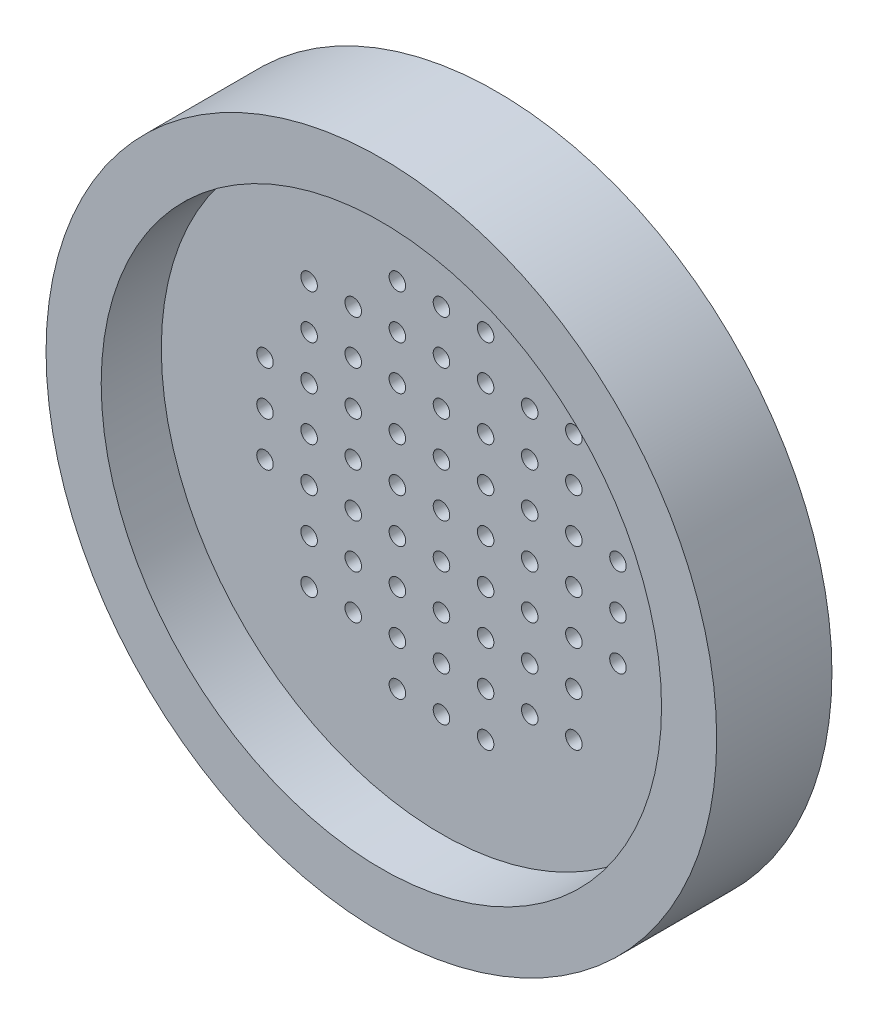
from build123d import *

# Parameters (mm, degrees)
SKETCH1_R                                  = 30.4
BOSS_EXTRUDE1_DEPTH                        = 5
SKETCH2_R                                  = 0.75
CUT_EXTRUDE1_DEPTH                         = 44.281866873
LPATTERN1_COUNT                            = 5
LPATTERN1_PITCH                            = 4
LPATTERN1_COUNT_DIR2                       = 5
LPATTERN1_PITCH_DIR2                       = 4
MIRROR1_COPY_1_SKETCH_R                    = 0.75
MIRROR1_COPY_1_DEPTH                       = 44.281866873
MIRROR1_COPY_2_SKETCH_R                    = 0.75
MIRROR1_COPY_2_DEPTH                       = 44.281866873
MIRROR1_COPY_3_SKETCH_R                    = 0.75
MIRROR1_COPY_3_DEPTH                       = 44.281866873
MIRROR1_COPY_4_SKETCH_R                    = 0.75
MIRROR1_COPY_4_DEPTH                       = 44.281866873
MIRROR1_COPY_5_SKETCH_R                    = 0.75
MIRROR1_COPY_5_DEPTH                       = 44.281866873
MIRROR1_COPY_6_SKETCH_R                    = 0.75
MIRROR1_COPY_6_DEPTH                       = 44.281866873
MIRROR1_COPY_7_SKETCH_R                    = 0.75
MIRROR1_COPY_7_DEPTH                       = 44.281866873
MIRROR1_COPY_8_SKETCH_R                    = 0.75
MIRROR1_COPY_8_DEPTH                       = 44.281866873
MIRROR1_COPY_9_SKETCH_R                    = 0.75
MIRROR1_COPY_9_DEPTH                       = 44.281866873
MIRROR1_COPY_10_SKETCH_R                   = 0.75
MIRROR1_COPY_10_DEPTH                      = 44.281866873
MIRROR1_COPY_11_SKETCH_R                   = 0.75
MIRROR1_COPY_11_DEPTH                      = 44.281866873
MIRROR1_COPY_12_SKETCH_R                   = 0.75
MIRROR1_COPY_12_DEPTH                      = 44.281866873
MIRROR1_COPY_13_SKETCH_R                   = 0.75
MIRROR1_COPY_13_DEPTH                      = 44.281866873
MIRROR1_COPY_14_SKETCH_R                   = 0.75
MIRROR1_COPY_14_DEPTH                      = 44.281866873
MIRROR1_COPY_15_SKETCH_R                   = 0.75
MIRROR1_COPY_15_DEPTH                      = 44.281866873
MIRROR1_COPY_16_SKETCH_R                   = 0.75
MIRROR1_COPY_16_DEPTH                      = 44.281866873
MIRROR1_COPY_17_SKETCH_R                   = 0.75
MIRROR1_COPY_17_DEPTH                      = 44.281866873
MIRROR1_COPY_18_SKETCH_R                   = 0.75
MIRROR1_COPY_18_DEPTH                      = 44.281866873
MIRROR1_COPY_19_SKETCH_R                   = 0.75
MIRROR1_COPY_19_DEPTH                      = 44.281866873
MIRROR1_COPY_20_SKETCH_R                   = 0.75
MIRROR1_COPY_20_DEPTH                      = 44.281866873
MIRROR1_AT_THE_SECOND_PLANE_COPY_1_SKETC_R = 0.75
MIRROR1_AT_THE_SECOND_PLANE_COPY_1_DEPTH   = 44.281866873
MIRROR1_AT_THE_SECOND_PLANE_COPY_2_SKETC_R = 0.75
MIRROR1_AT_THE_SECOND_PLANE_COPY_2_DEPTH   = 44.281866873
MIRROR1_AT_THE_SECOND_PLANE_COPY_3_SKETC_R = 0.75
MIRROR1_AT_THE_SECOND_PLANE_COPY_3_DEPTH   = 44.281866873
MIRROR1_AT_THE_SECOND_PLANE_COPY_4_SKETC_R = 0.75
MIRROR1_AT_THE_SECOND_PLANE_COPY_4_DEPTH   = 44.281866873
MIRROR1_AT_THE_SECOND_PLANE_COPY_5_SKETC_R = 0.75
MIRROR1_AT_THE_SECOND_PLANE_COPY_5_DEPTH   = 44.281866873
MIRROR1_AT_THE_SECOND_PLANE_COPY_6_SKETC_R = 0.75
MIRROR1_AT_THE_SECOND_PLANE_COPY_6_DEPTH   = 44.281866873
MIRROR1_AT_THE_SECOND_PLANE_COPY_7_SKETC_R = 0.75
MIRROR1_AT_THE_SECOND_PLANE_COPY_7_DEPTH   = 44.281866873
MIRROR1_AT_THE_SECOND_PLANE_COPY_8_SKETC_R = 0.75
MIRROR1_AT_THE_SECOND_PLANE_COPY_8_DEPTH   = 44.281866873
MIRROR1_AT_THE_SECOND_PLANE_COPY_9_SKETC_R = 0.75
MIRROR1_AT_THE_SECOND_PLANE_COPY_9_DEPTH   = 44.281866873
MIRROR1_AT_THE_SECOND_PLANE_COPY_10_SKET_R = 0.75
MIRROR1_AT_THE_SECOND_PLANE_COPY_10_DEPTH  = 44.281866873
MIRROR1_AT_THE_SECOND_PLANE_COPY_11_SKET_R = 0.75
MIRROR1_AT_THE_SECOND_PLANE_COPY_11_DEPTH  = 44.281866873
MIRROR1_AT_THE_SECOND_PLANE_COPY_12_SKET_R = 0.75
MIRROR1_AT_THE_SECOND_PLANE_COPY_12_DEPTH  = 44.281866873
MIRROR1_AT_THE_SECOND_PLANE_COPY_13_SKET_R = 0.75
MIRROR1_AT_THE_SECOND_PLANE_COPY_13_DEPTH  = 44.281866873
MIRROR1_AT_THE_SECOND_PLANE_COPY_14_SKET_R = 0.75
MIRROR1_AT_THE_SECOND_PLANE_COPY_14_DEPTH  = 44.281866873
MIRROR1_AT_THE_SECOND_PLANE_COPY_15_SKET_R = 0.75
MIRROR1_AT_THE_SECOND_PLANE_COPY_15_DEPTH  = 44.281866873
MIRROR1_AT_THE_SECOND_PLANE_COPY_16_SKET_R = 0.75
MIRROR1_AT_THE_SECOND_PLANE_COPY_16_DEPTH  = 44.281866873
MIRROR1_AT_THE_SECOND_PLANE_COPY_17_SKET_R = 0.75
MIRROR1_AT_THE_SECOND_PLANE_COPY_17_DEPTH  = 44.281866873
MIRROR1_AT_THE_SECOND_PLANE_COPY_18_SKET_R = 0.75
MIRROR1_AT_THE_SECOND_PLANE_COPY_18_DEPTH  = 44.281866873
MIRROR1_AT_THE_SECOND_PLANE_COPY_19_SKET_R = 0.75
MIRROR1_AT_THE_SECOND_PLANE_COPY_19_DEPTH  = 44.281866873
MIRROR1_AT_THE_SECOND_PLANE_COPY_20_SKET_R = 0.75
MIRROR1_AT_THE_SECOND_PLANE_COPY_20_DEPTH  = 44.281866873
MIRROR1_AT_THE_SECOND_PLANE_COPY_21_SKET_R = 0.75
MIRROR1_AT_THE_SECOND_PLANE_COPY_21_DEPTH  = 44.281866873
MIRROR1_AT_THE_SECOND_PLANE_COPY_22_SKET_R = 0.75
MIRROR1_AT_THE_SECOND_PLANE_COPY_22_DEPTH  = 44.281866873
MIRROR1_AT_THE_SECOND_PLANE_COPY_23_SKET_R = 0.75
MIRROR1_AT_THE_SECOND_PLANE_COPY_23_DEPTH  = 44.281866873
MIRROR1_AT_THE_SECOND_PLANE_COPY_24_SKET_R = 0.75
MIRROR1_AT_THE_SECOND_PLANE_COPY_24_DEPTH  = 44.281866873
MIRROR1_AT_THE_SECOND_PLANE_COPY_25_SKET_R = 0.75
MIRROR1_AT_THE_SECOND_PLANE_COPY_25_DEPTH  = 44.281866873
MIRROR1_AT_THE_SECOND_PLANE_COPY_26_SKET_R = 0.75
MIRROR1_AT_THE_SECOND_PLANE_COPY_26_DEPTH  = 44.281866873
MIRROR1_AT_THE_SECOND_PLANE_COPY_27_SKET_R = 0.75
MIRROR1_AT_THE_SECOND_PLANE_COPY_27_DEPTH  = 44.281866873
MIRROR1_AT_THE_SECOND_PLANE_COPY_28_SKET_R = 0.75
MIRROR1_AT_THE_SECOND_PLANE_COPY_28_DEPTH  = 44.281866873
MIRROR1_AT_THE_SECOND_PLANE_COPY_29_SKET_R = 0.75
MIRROR1_AT_THE_SECOND_PLANE_COPY_29_DEPTH  = 44.281866873
MIRROR1_AT_THE_SECOND_PLANE_COPY_30_SKET_R = 0.75
MIRROR1_AT_THE_SECOND_PLANE_COPY_30_DEPTH  = 44.281866873
MIRROR1_AT_THE_SECOND_PLANE_COPY_31_SKET_R = 0.75
MIRROR1_AT_THE_SECOND_PLANE_COPY_31_DEPTH  = 44.281866873
MIRROR1_AT_THE_SECOND_PLANE_COPY_32_SKET_R = 0.75
MIRROR1_AT_THE_SECOND_PLANE_COPY_32_DEPTH  = 44.281866873
MIRROR1_AT_THE_SECOND_PLANE_COPY_33_SKET_R = 0.75
MIRROR1_AT_THE_SECOND_PLANE_COPY_33_DEPTH  = 44.281866873
MIRROR1_AT_THE_SECOND_PLANE_COPY_34_SKET_R = 0.75
MIRROR1_AT_THE_SECOND_PLANE_COPY_34_DEPTH  = 44.281866873
MIRROR1_AT_THE_SECOND_PLANE_COPY_35_SKET_R = 0.75
MIRROR1_AT_THE_SECOND_PLANE_COPY_35_DEPTH  = 44.281866873
MIRROR1_AT_THE_SECOND_PLANE_COPY_36_SKET_R = 0.75
MIRROR1_AT_THE_SECOND_PLANE_COPY_36_DEPTH  = 44.281866873
MIRROR1_AT_THE_SECOND_PLANE_COPY_37_SKET_R = 0.75
MIRROR1_AT_THE_SECOND_PLANE_COPY_37_DEPTH  = 44.281866873
MIRROR1_AT_THE_SECOND_PLANE_COPY_38_SKET_R = 0.75
MIRROR1_AT_THE_SECOND_PLANE_COPY_38_DEPTH  = 44.281866873
MIRROR1_AT_THE_SECOND_PLANE_COPY_39_SKET_R = 0.75
MIRROR1_AT_THE_SECOND_PLANE_COPY_39_DEPTH  = 44.281866873
MIRROR1_AT_THE_SECOND_PLANE_COPY_40_SKET_R = 0.75
MIRROR1_AT_THE_SECOND_PLANE_COPY_40_DEPTH  = 44.281866873
MIRROR1_AT_THE_SECOND_PLANE_COPY_41_SKET_R = 0.75
MIRROR1_AT_THE_SECOND_PLANE_COPY_41_DEPTH  = 44.281866873
SKETCH16_R                                 = 30.4
SKETCH16_R_2                               = 25.4
BOSS_EXTRUDE2_DEPTH                        = 5.45


with BuildPart() as part:
    # Sketch1 → Boss-Extrude1 (new body)
    with BuildSketch(Plane.XY):
        Circle(SKETCH1_R)
    extrude(amount=BOSS_EXTRUDE1_DEPTH)

    # Sketch2 → Cut-Extrude1 (cut, through all)
    with BuildSketch(Plane.XY.offset(5)):
        Circle(SKETCH2_R)
    cut_extrude1 = extrude(amount=-CUT_EXTRUDE1_DEPTH, mode=Mode.SUBTRACT)

    # LPattern1: Cut-Extrude1 5 × 5, 5 skipped
    with Locations(*[(j * LPATTERN1_PITCH_DIR2, i * LPATTERN1_PITCH, 0) for i in range(LPATTERN1_COUNT) for j in range(LPATTERN1_COUNT_DIR2) if (i, j) not in ((0, 0), (2, 4), (3, 4), (4, 2), (4, 3), (4, 4))]):
        add(cut_extrude1, mode=Mode.SUBTRACT)

    # Mirror1 copy 1 sketch → Mirror1 copy 1 (cut, through all)
    with BuildSketch(Plane(origin=(-4, 0, 5), x_dir=(-1, 0, 0), z_dir=(0, 0, 1))):
        Circle(MIRROR1_COPY_1_SKETCH_R)
    extrude(amount=-MIRROR1_COPY_1_DEPTH, mode=Mode.SUBTRACT)

    # Mirror1 copy 2 sketch → Mirror1 copy 2 (cut, through all)
    with BuildSketch(Plane(origin=(-8, 0, 5), x_dir=(-1, 0, 0), z_dir=(0, 0, 1))):
        Circle(MIRROR1_COPY_2_SKETCH_R)
    extrude(amount=-MIRROR1_COPY_2_DEPTH, mode=Mode.SUBTRACT)

    # Mirror1 copy 3 sketch → Mirror1 copy 3 (cut, through all)
    with BuildSketch(Plane(origin=(-12, 0, 5), x_dir=(-1, 0, 0), z_dir=(0, 0, 1))):
        Circle(MIRROR1_COPY_3_SKETCH_R)
    extrude(amount=-MIRROR1_COPY_3_DEPTH, mode=Mode.SUBTRACT)

    # Mirror1 copy 4 sketch → Mirror1 copy 4 (cut, through all)
    with BuildSketch(Plane(origin=(-16, 0, 5), x_dir=(-1, 0, 0), z_dir=(0, 0, 1))):
        Circle(MIRROR1_COPY_4_SKETCH_R)
    extrude(amount=-MIRROR1_COPY_4_DEPTH, mode=Mode.SUBTRACT)

    # Mirror1 copy 5 sketch → Mirror1 copy 5 (cut, through all)
    with BuildSketch(Plane(origin=(0, 4, 5), x_dir=(-1, 0, 0), z_dir=(0, 0, 1))):
        Circle(MIRROR1_COPY_5_SKETCH_R)
    extrude(amount=-MIRROR1_COPY_5_DEPTH, mode=Mode.SUBTRACT)

    # Mirror1 copy 6 sketch → Mirror1 copy 6 (cut, through all)
    with BuildSketch(Plane(origin=(-4, 4, 5), x_dir=(-1, 0, 0), z_dir=(0, 0, 1))):
        Circle(MIRROR1_COPY_6_SKETCH_R)
    extrude(amount=-MIRROR1_COPY_6_DEPTH, mode=Mode.SUBTRACT)

    # Mirror1 copy 7 sketch → Mirror1 copy 7 (cut, through all)
    with BuildSketch(Plane(origin=(-8, 4, 5), x_dir=(-1, 0, 0), z_dir=(0, 0, 1))):
        Circle(MIRROR1_COPY_7_SKETCH_R)
    extrude(amount=-MIRROR1_COPY_7_DEPTH, mode=Mode.SUBTRACT)

    # Mirror1 copy 8 sketch → Mirror1 copy 8 (cut, through all)
    with BuildSketch(Plane(origin=(-12, 4, 5), x_dir=(-1, 0, 0), z_dir=(0, 0, 1))):
        Circle(MIRROR1_COPY_8_SKETCH_R)
    extrude(amount=-MIRROR1_COPY_8_DEPTH, mode=Mode.SUBTRACT)

    # Mirror1 copy 9 sketch → Mirror1 copy 9 (cut, through all)
    with BuildSketch(Plane(origin=(-16, 4, 5), x_dir=(-1, 0, 0), z_dir=(0, 0, 1))):
        Circle(MIRROR1_COPY_9_SKETCH_R)
    extrude(amount=-MIRROR1_COPY_9_DEPTH, mode=Mode.SUBTRACT)

    # Mirror1 copy 10 sketch → Mirror1 copy 10 (cut, through all)
    with BuildSketch(Plane(origin=(0, 8, 5), x_dir=(-1, 0, 0), z_dir=(0, 0, 1))):
        Circle(MIRROR1_COPY_10_SKETCH_R)
    extrude(amount=-MIRROR1_COPY_10_DEPTH, mode=Mode.SUBTRACT)

    # Mirror1 copy 11 sketch → Mirror1 copy 11 (cut, through all)
    with BuildSketch(Plane(origin=(-4, 8, 5), x_dir=(-1, 0, 0), z_dir=(0, 0, 1))):
        Circle(MIRROR1_COPY_11_SKETCH_R)
    extrude(amount=-MIRROR1_COPY_11_DEPTH, mode=Mode.SUBTRACT)

    # Mirror1 copy 12 sketch → Mirror1 copy 12 (cut, through all)
    with BuildSketch(Plane(origin=(-8, 8, 5), x_dir=(-1, 0, 0), z_dir=(0, 0, 1))):
        Circle(MIRROR1_COPY_12_SKETCH_R)
    extrude(amount=-MIRROR1_COPY_12_DEPTH, mode=Mode.SUBTRACT)

    # Mirror1 copy 13 sketch → Mirror1 copy 13 (cut, through all)
    with BuildSketch(Plane(origin=(-12, 8, 5), x_dir=(-1, 0, 0), z_dir=(0, 0, 1))):
        Circle(MIRROR1_COPY_13_SKETCH_R)
    extrude(amount=-MIRROR1_COPY_13_DEPTH, mode=Mode.SUBTRACT)

    # Mirror1 copy 14 sketch → Mirror1 copy 14 (cut, through all)
    with BuildSketch(Plane(origin=(0, 12, 5), x_dir=(-1, 0, 0), z_dir=(0, 0, 1))):
        Circle(MIRROR1_COPY_14_SKETCH_R)
    extrude(amount=-MIRROR1_COPY_14_DEPTH, mode=Mode.SUBTRACT)

    # Mirror1 copy 15 sketch → Mirror1 copy 15 (cut, through all)
    with BuildSketch(Plane(origin=(-4, 12, 5), x_dir=(-1, 0, 0), z_dir=(0, 0, 1))):
        Circle(MIRROR1_COPY_15_SKETCH_R)
    extrude(amount=-MIRROR1_COPY_15_DEPTH, mode=Mode.SUBTRACT)

    # Mirror1 copy 16 sketch → Mirror1 copy 16 (cut, through all)
    with BuildSketch(Plane(origin=(-8, 12, 5), x_dir=(-1, 0, 0), z_dir=(0, 0, 1))):
        Circle(MIRROR1_COPY_16_SKETCH_R)
    extrude(amount=-MIRROR1_COPY_16_DEPTH, mode=Mode.SUBTRACT)

    # Mirror1 copy 17 sketch → Mirror1 copy 17 (cut, through all)
    with BuildSketch(Plane(origin=(-12, 12, 5), x_dir=(-1, 0, 0), z_dir=(0, 0, 1))):
        Circle(MIRROR1_COPY_17_SKETCH_R)
    extrude(amount=-MIRROR1_COPY_17_DEPTH, mode=Mode.SUBTRACT)

    # Mirror1 copy 18 sketch → Mirror1 copy 18 (cut, through all)
    with BuildSketch(Plane(origin=(0, 16, 5), x_dir=(-1, 0, 0), z_dir=(0, 0, 1))):
        Circle(MIRROR1_COPY_18_SKETCH_R)
    extrude(amount=-MIRROR1_COPY_18_DEPTH, mode=Mode.SUBTRACT)

    # Mirror1 copy 19 sketch → Mirror1 copy 19 (cut, through all)
    with BuildSketch(Plane(origin=(-4, 16, 5), x_dir=(-1, 0, 0), z_dir=(0, 0, 1))):
        Circle(MIRROR1_COPY_19_SKETCH_R)
    extrude(amount=-MIRROR1_COPY_19_DEPTH, mode=Mode.SUBTRACT)

    # Mirror1 copy 20 sketch → Mirror1 copy 20 (cut, through all)
    with BuildSketch(Plane(origin=(0, 0, 5), x_dir=(-1, 0, 0), z_dir=(0, 0, 1))):
        Circle(MIRROR1_COPY_20_SKETCH_R)
    extrude(amount=-MIRROR1_COPY_20_DEPTH, mode=Mode.SUBTRACT)

    # Mirror1 at the second plane copy 1 sketc → Mirror1 at the second plane copy 1 (cut, through all)
    with BuildSketch(Plane(origin=(4, 0, 5), x_dir=(1, 0, 0), z_dir=(0, 0, 1))):
        Circle(MIRROR1_AT_THE_SECOND_PLANE_COPY_1_SKETC_R)
    extrude(amount=-MIRROR1_AT_THE_SECOND_PLANE_COPY_1_DEPTH, mode=Mode.SUBTRACT)

    # Mirror1 at the second plane copy 2 sketc → Mirror1 at the second plane copy 2 (cut, through all)
    with BuildSketch(Plane(origin=(8, 0, 5), x_dir=(1, 0, 0), z_dir=(0, 0, 1))):
        Circle(MIRROR1_AT_THE_SECOND_PLANE_COPY_2_SKETC_R)
    extrude(amount=-MIRROR1_AT_THE_SECOND_PLANE_COPY_2_DEPTH, mode=Mode.SUBTRACT)

    # Mirror1 at the second plane copy 3 sketc → Mirror1 at the second plane copy 3 (cut, through all)
    with BuildSketch(Plane(origin=(12, 0, 5), x_dir=(1, 0, 0), z_dir=(0, 0, 1))):
        Circle(MIRROR1_AT_THE_SECOND_PLANE_COPY_3_SKETC_R)
    extrude(amount=-MIRROR1_AT_THE_SECOND_PLANE_COPY_3_DEPTH, mode=Mode.SUBTRACT)

    # Mirror1 at the second plane copy 4 sketc → Mirror1 at the second plane copy 4 (cut, through all)
    with BuildSketch(Plane(origin=(16, 0, 5), x_dir=(1, 0, 0), z_dir=(0, 0, 1))):
        Circle(MIRROR1_AT_THE_SECOND_PLANE_COPY_4_SKETC_R)
    extrude(amount=-MIRROR1_AT_THE_SECOND_PLANE_COPY_4_DEPTH, mode=Mode.SUBTRACT)

    # Mirror1 at the second plane copy 5 sketc → Mirror1 at the second plane copy 5 (cut, through all)
    with BuildSketch(Plane(origin=(0, -4, 5), x_dir=(1, 0, 0), z_dir=(0, 0, 1))):
        Circle(MIRROR1_AT_THE_SECOND_PLANE_COPY_5_SKETC_R)
    extrude(amount=-MIRROR1_AT_THE_SECOND_PLANE_COPY_5_DEPTH, mode=Mode.SUBTRACT)

    # Mirror1 at the second plane copy 6 sketc → Mirror1 at the second plane copy 6 (cut, through all)
    with BuildSketch(Plane(origin=(4, -4, 5), x_dir=(1, 0, 0), z_dir=(0, 0, 1))):
        Circle(MIRROR1_AT_THE_SECOND_PLANE_COPY_6_SKETC_R)
    extrude(amount=-MIRROR1_AT_THE_SECOND_PLANE_COPY_6_DEPTH, mode=Mode.SUBTRACT)

    # Mirror1 at the second plane copy 7 sketc → Mirror1 at the second plane copy 7 (cut, through all)
    with BuildSketch(Plane(origin=(8, -4, 5), x_dir=(1, 0, 0), z_dir=(0, 0, 1))):
        Circle(MIRROR1_AT_THE_SECOND_PLANE_COPY_7_SKETC_R)
    extrude(amount=-MIRROR1_AT_THE_SECOND_PLANE_COPY_7_DEPTH, mode=Mode.SUBTRACT)

    # Mirror1 at the second plane copy 8 sketc → Mirror1 at the second plane copy 8 (cut, through all)
    with BuildSketch(Plane(origin=(12, -4, 5), x_dir=(1, 0, 0), z_dir=(0, 0, 1))):
        Circle(MIRROR1_AT_THE_SECOND_PLANE_COPY_8_SKETC_R)
    extrude(amount=-MIRROR1_AT_THE_SECOND_PLANE_COPY_8_DEPTH, mode=Mode.SUBTRACT)

    # Mirror1 at the second plane copy 9 sketc → Mirror1 at the second plane copy 9 (cut, through all)
    with BuildSketch(Plane(origin=(16, -4, 5), x_dir=(1, 0, 0), z_dir=(0, 0, 1))):
        Circle(MIRROR1_AT_THE_SECOND_PLANE_COPY_9_SKETC_R)
    extrude(amount=-MIRROR1_AT_THE_SECOND_PLANE_COPY_9_DEPTH, mode=Mode.SUBTRACT)

    # Mirror1 at the second plane copy 10 sket → Mirror1 at the second plane copy 10 (cut, through all)
    with BuildSketch(Plane(origin=(0, -8, 5), x_dir=(1, 0, 0), z_dir=(0, 0, 1))):
        Circle(MIRROR1_AT_THE_SECOND_PLANE_COPY_10_SKET_R)
    extrude(amount=-MIRROR1_AT_THE_SECOND_PLANE_COPY_10_DEPTH, mode=Mode.SUBTRACT)

    # Mirror1 at the second plane copy 11 sket → Mirror1 at the second plane copy 11 (cut, through all)
    with BuildSketch(Plane(origin=(4, -8, 5), x_dir=(1, 0, 0), z_dir=(0, 0, 1))):
        Circle(MIRROR1_AT_THE_SECOND_PLANE_COPY_11_SKET_R)
    extrude(amount=-MIRROR1_AT_THE_SECOND_PLANE_COPY_11_DEPTH, mode=Mode.SUBTRACT)

    # Mirror1 at the second plane copy 12 sket → Mirror1 at the second plane copy 12 (cut, through all)
    with BuildSketch(Plane(origin=(8, -8, 5), x_dir=(1, 0, 0), z_dir=(0, 0, 1))):
        Circle(MIRROR1_AT_THE_SECOND_PLANE_COPY_12_SKET_R)
    extrude(amount=-MIRROR1_AT_THE_SECOND_PLANE_COPY_12_DEPTH, mode=Mode.SUBTRACT)

    # Mirror1 at the second plane copy 13 sket → Mirror1 at the second plane copy 13 (cut, through all)
    with BuildSketch(Plane(origin=(12, -8, 5), x_dir=(1, 0, 0), z_dir=(0, 0, 1))):
        Circle(MIRROR1_AT_THE_SECOND_PLANE_COPY_13_SKET_R)
    extrude(amount=-MIRROR1_AT_THE_SECOND_PLANE_COPY_13_DEPTH, mode=Mode.SUBTRACT)

    # Mirror1 at the second plane copy 14 sket → Mirror1 at the second plane copy 14 (cut, through all)
    with BuildSketch(Plane(origin=(0, -12, 5), x_dir=(1, 0, 0), z_dir=(0, 0, 1))):
        Circle(MIRROR1_AT_THE_SECOND_PLANE_COPY_14_SKET_R)
    extrude(amount=-MIRROR1_AT_THE_SECOND_PLANE_COPY_14_DEPTH, mode=Mode.SUBTRACT)

    # Mirror1 at the second plane copy 15 sket → Mirror1 at the second plane copy 15 (cut, through all)
    with BuildSketch(Plane(origin=(4, -12, 5), x_dir=(1, 0, 0), z_dir=(0, 0, 1))):
        Circle(MIRROR1_AT_THE_SECOND_PLANE_COPY_15_SKET_R)
    extrude(amount=-MIRROR1_AT_THE_SECOND_PLANE_COPY_15_DEPTH, mode=Mode.SUBTRACT)

    # Mirror1 at the second plane copy 16 sket → Mirror1 at the second plane copy 16 (cut, through all)
    with BuildSketch(Plane(origin=(8, -12, 5), x_dir=(1, 0, 0), z_dir=(0, 0, 1))):
        Circle(MIRROR1_AT_THE_SECOND_PLANE_COPY_16_SKET_R)
    extrude(amount=-MIRROR1_AT_THE_SECOND_PLANE_COPY_16_DEPTH, mode=Mode.SUBTRACT)

    # Mirror1 at the second plane copy 17 sket → Mirror1 at the second plane copy 17 (cut, through all)
    with BuildSketch(Plane(origin=(12, -12, 5), x_dir=(1, 0, 0), z_dir=(0, 0, 1))):
        Circle(MIRROR1_AT_THE_SECOND_PLANE_COPY_17_SKET_R)
    extrude(amount=-MIRROR1_AT_THE_SECOND_PLANE_COPY_17_DEPTH, mode=Mode.SUBTRACT)

    # Mirror1 at the second plane copy 18 sket → Mirror1 at the second plane copy 18 (cut, through all)
    with BuildSketch(Plane(origin=(0, -16, 5), x_dir=(1, 0, 0), z_dir=(0, 0, 1))):
        Circle(MIRROR1_AT_THE_SECOND_PLANE_COPY_18_SKET_R)
    extrude(amount=-MIRROR1_AT_THE_SECOND_PLANE_COPY_18_DEPTH, mode=Mode.SUBTRACT)

    # Mirror1 at the second plane copy 19 sket → Mirror1 at the second plane copy 19 (cut, through all)
    with BuildSketch(Plane(origin=(4, -16, 5), x_dir=(1, 0, 0), z_dir=(0, 0, 1))):
        Circle(MIRROR1_AT_THE_SECOND_PLANE_COPY_19_SKET_R)
    extrude(amount=-MIRROR1_AT_THE_SECOND_PLANE_COPY_19_DEPTH, mode=Mode.SUBTRACT)

    # Mirror1 at the second plane copy 20 sket → Mirror1 at the second plane copy 20 (cut, through all)
    with BuildSketch(Plane.XY.offset(5)):
        Circle(MIRROR1_AT_THE_SECOND_PLANE_COPY_20_SKET_R)
    extrude(amount=-MIRROR1_AT_THE_SECOND_PLANE_COPY_20_DEPTH, mode=Mode.SUBTRACT)

    # Mirror1 at the second plane copy 21 sket → Mirror1 at the second plane copy 21 (cut, through all)
    with BuildSketch(Plane(origin=(-4, 0, 5), x_dir=(-1, 0, 0), z_dir=(0, 0, 1))):
        Circle(MIRROR1_AT_THE_SECOND_PLANE_COPY_21_SKET_R)
    extrude(amount=-MIRROR1_AT_THE_SECOND_PLANE_COPY_21_DEPTH, mode=Mode.SUBTRACT)

    # Mirror1 at the second plane copy 22 sket → Mirror1 at the second plane copy 22 (cut, through all)
    with BuildSketch(Plane(origin=(-8, 0, 5), x_dir=(-1, 0, 0), z_dir=(0, 0, 1))):
        Circle(MIRROR1_AT_THE_SECOND_PLANE_COPY_22_SKET_R)
    extrude(amount=-MIRROR1_AT_THE_SECOND_PLANE_COPY_22_DEPTH, mode=Mode.SUBTRACT)

    # Mirror1 at the second plane copy 23 sket → Mirror1 at the second plane copy 23 (cut, through all)
    with BuildSketch(Plane(origin=(-12, 0, 5), x_dir=(-1, 0, 0), z_dir=(0, 0, 1))):
        Circle(MIRROR1_AT_THE_SECOND_PLANE_COPY_23_SKET_R)
    extrude(amount=-MIRROR1_AT_THE_SECOND_PLANE_COPY_23_DEPTH, mode=Mode.SUBTRACT)

    # Mirror1 at the second plane copy 24 sket → Mirror1 at the second plane copy 24 (cut, through all)
    with BuildSketch(Plane(origin=(-16, 0, 5), x_dir=(-1, 0, 0), z_dir=(0, 0, 1))):
        Circle(MIRROR1_AT_THE_SECOND_PLANE_COPY_24_SKET_R)
    extrude(amount=-MIRROR1_AT_THE_SECOND_PLANE_COPY_24_DEPTH, mode=Mode.SUBTRACT)

    # Mirror1 at the second plane copy 25 sket → Mirror1 at the second plane copy 25 (cut, through all)
    with BuildSketch(Plane(origin=(0, -4, 5), x_dir=(-1, 0, 0), z_dir=(0, 0, 1))):
        Circle(MIRROR1_AT_THE_SECOND_PLANE_COPY_25_SKET_R)
    extrude(amount=-MIRROR1_AT_THE_SECOND_PLANE_COPY_25_DEPTH, mode=Mode.SUBTRACT)

    # Mirror1 at the second plane copy 26 sket → Mirror1 at the second plane copy 26 (cut, through all)
    with BuildSketch(Plane(origin=(-4, -4, 5), x_dir=(-1, 0, 0), z_dir=(0, 0, 1))):
        Circle(MIRROR1_AT_THE_SECOND_PLANE_COPY_26_SKET_R)
    extrude(amount=-MIRROR1_AT_THE_SECOND_PLANE_COPY_26_DEPTH, mode=Mode.SUBTRACT)

    # Mirror1 at the second plane copy 27 sket → Mirror1 at the second plane copy 27 (cut, through all)
    with BuildSketch(Plane(origin=(-8, -4, 5), x_dir=(-1, 0, 0), z_dir=(0, 0, 1))):
        Circle(MIRROR1_AT_THE_SECOND_PLANE_COPY_27_SKET_R)
    extrude(amount=-MIRROR1_AT_THE_SECOND_PLANE_COPY_27_DEPTH, mode=Mode.SUBTRACT)

    # Mirror1 at the second plane copy 28 sket → Mirror1 at the second plane copy 28 (cut, through all)
    with BuildSketch(Plane(origin=(-12, -4, 5), x_dir=(-1, 0, 0), z_dir=(0, 0, 1))):
        Circle(MIRROR1_AT_THE_SECOND_PLANE_COPY_28_SKET_R)
    extrude(amount=-MIRROR1_AT_THE_SECOND_PLANE_COPY_28_DEPTH, mode=Mode.SUBTRACT)

    # Mirror1 at the second plane copy 29 sket → Mirror1 at the second plane copy 29 (cut, through all)
    with BuildSketch(Plane(origin=(-16, -4, 5), x_dir=(-1, 0, 0), z_dir=(0, 0, 1))):
        Circle(MIRROR1_AT_THE_SECOND_PLANE_COPY_29_SKET_R)
    extrude(amount=-MIRROR1_AT_THE_SECOND_PLANE_COPY_29_DEPTH, mode=Mode.SUBTRACT)

    # Mirror1 at the second plane copy 30 sket → Mirror1 at the second plane copy 30 (cut, through all)
    with BuildSketch(Plane(origin=(0, -8, 5), x_dir=(-1, 0, 0), z_dir=(0, 0, 1))):
        Circle(MIRROR1_AT_THE_SECOND_PLANE_COPY_30_SKET_R)
    extrude(amount=-MIRROR1_AT_THE_SECOND_PLANE_COPY_30_DEPTH, mode=Mode.SUBTRACT)

    # Mirror1 at the second plane copy 31 sket → Mirror1 at the second plane copy 31 (cut, through all)
    with BuildSketch(Plane(origin=(-4, -8, 5), x_dir=(-1, 0, 0), z_dir=(0, 0, 1))):
        Circle(MIRROR1_AT_THE_SECOND_PLANE_COPY_31_SKET_R)
    extrude(amount=-MIRROR1_AT_THE_SECOND_PLANE_COPY_31_DEPTH, mode=Mode.SUBTRACT)

    # Mirror1 at the second plane copy 32 sket → Mirror1 at the second plane copy 32 (cut, through all)
    with BuildSketch(Plane(origin=(-8, -8, 5), x_dir=(-1, 0, 0), z_dir=(0, 0, 1))):
        Circle(MIRROR1_AT_THE_SECOND_PLANE_COPY_32_SKET_R)
    extrude(amount=-MIRROR1_AT_THE_SECOND_PLANE_COPY_32_DEPTH, mode=Mode.SUBTRACT)

    # Mirror1 at the second plane copy 33 sket → Mirror1 at the second plane copy 33 (cut, through all)
    with BuildSketch(Plane(origin=(-12, -8, 5), x_dir=(-1, 0, 0), z_dir=(0, 0, 1))):
        Circle(MIRROR1_AT_THE_SECOND_PLANE_COPY_33_SKET_R)
    extrude(amount=-MIRROR1_AT_THE_SECOND_PLANE_COPY_33_DEPTH, mode=Mode.SUBTRACT)

    # Mirror1 at the second plane copy 34 sket → Mirror1 at the second plane copy 34 (cut, through all)
    with BuildSketch(Plane(origin=(0, -12, 5), x_dir=(-1, 0, 0), z_dir=(0, 0, 1))):
        Circle(MIRROR1_AT_THE_SECOND_PLANE_COPY_34_SKET_R)
    extrude(amount=-MIRROR1_AT_THE_SECOND_PLANE_COPY_34_DEPTH, mode=Mode.SUBTRACT)

    # Mirror1 at the second plane copy 35 sket → Mirror1 at the second plane copy 35 (cut, through all)
    with BuildSketch(Plane(origin=(-4, -12, 5), x_dir=(-1, 0, 0), z_dir=(0, 0, 1))):
        Circle(MIRROR1_AT_THE_SECOND_PLANE_COPY_35_SKET_R)
    extrude(amount=-MIRROR1_AT_THE_SECOND_PLANE_COPY_35_DEPTH, mode=Mode.SUBTRACT)

    # Mirror1 at the second plane copy 36 sket → Mirror1 at the second plane copy 36 (cut, through all)
    with BuildSketch(Plane(origin=(-8, -12, 5), x_dir=(-1, 0, 0), z_dir=(0, 0, 1))):
        Circle(MIRROR1_AT_THE_SECOND_PLANE_COPY_36_SKET_R)
    extrude(amount=-MIRROR1_AT_THE_SECOND_PLANE_COPY_36_DEPTH, mode=Mode.SUBTRACT)

    # Mirror1 at the second plane copy 37 sket → Mirror1 at the second plane copy 37 (cut, through all)
    with BuildSketch(Plane(origin=(-12, -12, 5), x_dir=(-1, 0, 0), z_dir=(0, 0, 1))):
        Circle(MIRROR1_AT_THE_SECOND_PLANE_COPY_37_SKET_R)
    extrude(amount=-MIRROR1_AT_THE_SECOND_PLANE_COPY_37_DEPTH, mode=Mode.SUBTRACT)

    # Mirror1 at the second plane copy 38 sket → Mirror1 at the second plane copy 38 (cut, through all)
    with BuildSketch(Plane(origin=(0, -16, 5), x_dir=(-1, 0, 0), z_dir=(0, 0, 1))):
        Circle(MIRROR1_AT_THE_SECOND_PLANE_COPY_38_SKET_R)
    extrude(amount=-MIRROR1_AT_THE_SECOND_PLANE_COPY_38_DEPTH, mode=Mode.SUBTRACT)

    # Mirror1 at the second plane copy 39 sket → Mirror1 at the second plane copy 39 (cut, through all)
    with BuildSketch(Plane(origin=(-4, -16, 5), x_dir=(-1, 0, 0), z_dir=(0, 0, 1))):
        Circle(MIRROR1_AT_THE_SECOND_PLANE_COPY_39_SKET_R)
    extrude(amount=-MIRROR1_AT_THE_SECOND_PLANE_COPY_39_DEPTH, mode=Mode.SUBTRACT)

    # Mirror1 at the second plane copy 40 sket → Mirror1 at the second plane copy 40 (cut, through all)
    with BuildSketch(Plane(origin=(0, 0, 5), x_dir=(-1, 0, 0), z_dir=(0, 0, 1))):
        Circle(MIRROR1_AT_THE_SECOND_PLANE_COPY_40_SKET_R)
    extrude(amount=-MIRROR1_AT_THE_SECOND_PLANE_COPY_40_DEPTH, mode=Mode.SUBTRACT)

    # Mirror1 at the second plane copy 41 sket → Mirror1 at the second plane copy 41 (cut, through all)
    with BuildSketch(Plane.XY.offset(5)):
        Circle(MIRROR1_AT_THE_SECOND_PLANE_COPY_41_SKET_R)
    extrude(amount=-MIRROR1_AT_THE_SECOND_PLANE_COPY_41_DEPTH, mode=Mode.SUBTRACT)

    # Sketch16 → Boss-Extrude2 (add)
    with BuildSketch(Plane.XY.offset(5)):
        Circle(SKETCH16_R)
        Circle(SKETCH16_R_2, mode=Mode.SUBTRACT)
    extrude(amount=BOSS_EXTRUDE2_DEPTH)


solid = part.part
